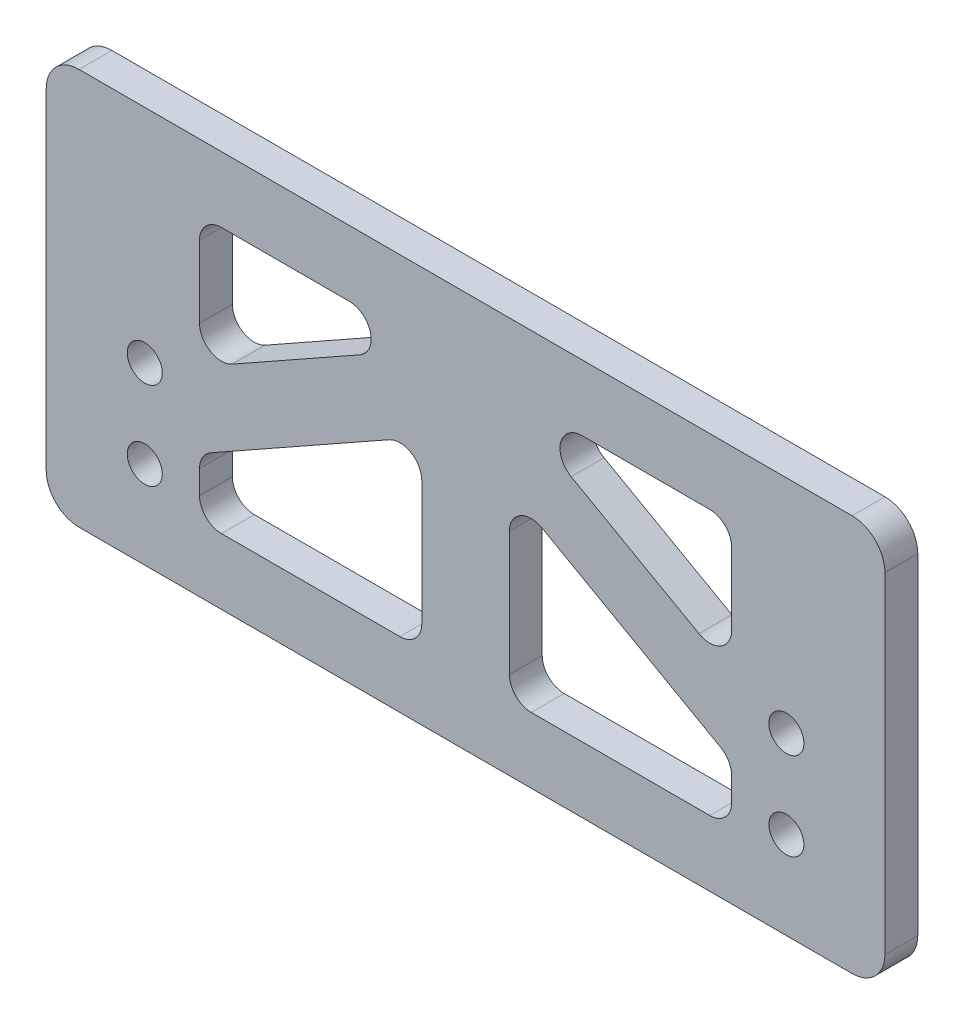
from build123d import *

# Parameters (mm, degrees)
SKETCH_1_W          = 76.6
SKETCH_1_H          = 36.210235533
SKETCH_1_R          = 1.6
EXTRUDE_1_DEPTH     = 3
FILLET_1_R          = 3
CUT_EXTRUDE_1_DEPTH = 102.368446486
FILLET_2_R          = 2


with BuildPart() as part:
    # 草图1 → 凸台-拉伸1 (new body)
    with BuildSketch(Plane.XY):
        with Locations((38.3, 48.219854477)):
            Rectangle(SKETCH_1_W, SKETCH_1_H)
        with Locations((9, 38.11473671)):
            Circle(SKETCH_1_R, mode=Mode.SUBTRACT)
        with Locations((9, 46.11473671)):
            Circle(SKETCH_1_R, mode=Mode.SUBTRACT)
        with Locations(Location((67.6, 38.11473671, 0), (0, 0, 180))):
            Circle(SKETCH_1_R, mode=Mode.SUBTRACT)
        with Locations(Location((67.6, 46.11473671, 0), (0, 0, 180))):
            Circle(SKETCH_1_R, mode=Mode.SUBTRACT)
    extrude(amount=EXTRUDE_1_DEPTH)

    # 圆角1
    fillet_1_edges = [part.edges().sort_by_distance(p)[0] for p in [
        (0, 66.324972243, 1.5),
        (76.6, 66.324972243, 1.5),
        (76.6, 30.11473671, 1.5),
        (0, 30.11473671, 1.5),
    ]]
    fillet(fillet_1_edges, radius=FILLET_1_R)

    # 草图2 → 切除-拉伸1 (cut, through all)
    with BuildSketch(Plane.XY.offset(3)):
        Polygon((14, 60.324972243), (35.3, 60.324972243), (14, 48.324972243), align=None)
        Polygon((62.6, 48.324972243), (41.3, 60.324972243), (62.6, 60.324972243), align=None)
        Polygon((34.3, 52.874916108), (14, 41.43829639), (14, 36.11473671), (34.3, 36.11473671), align=None)
        Polygon((62.6, 41.43829639), (62.6, 36.11473671), (42.3, 36.11473671), (42.3, 52.874916108), align=None)
    extrude(amount=-CUT_EXTRUDE_1_DEPTH, mode=Mode.SUBTRACT)

    # 圆角2
    fillet_2_edges = [part.edges().sort_by_distance(p)[0] for p in [
        (42.3, 52.874916108, 1.5),
        (62.6, 41.43829639, 1.5),
        (62.6, 36.11473671, 1.5),
        (42.3, 36.11473671, 1.5),
        (34.3, 36.11473671, 1.5),
        (14, 36.11473671, 1.5),
        (14, 41.43829639, 1.5),
        (34.3, 52.874916108, 1.5),
        (62.6, 60.324972243, 1.5),
        (62.6, 48.324972243, 1.5),
        (41.3, 60.324972243, 1.5),
        (14, 48.324972243, 1.5),
        (14, 60.324972243, 1.5),
        (35.3, 60.324972243, 1.5),
    ]]
    fillet(fillet_2_edges, radius=FILLET_2_R)


solid = part.part
